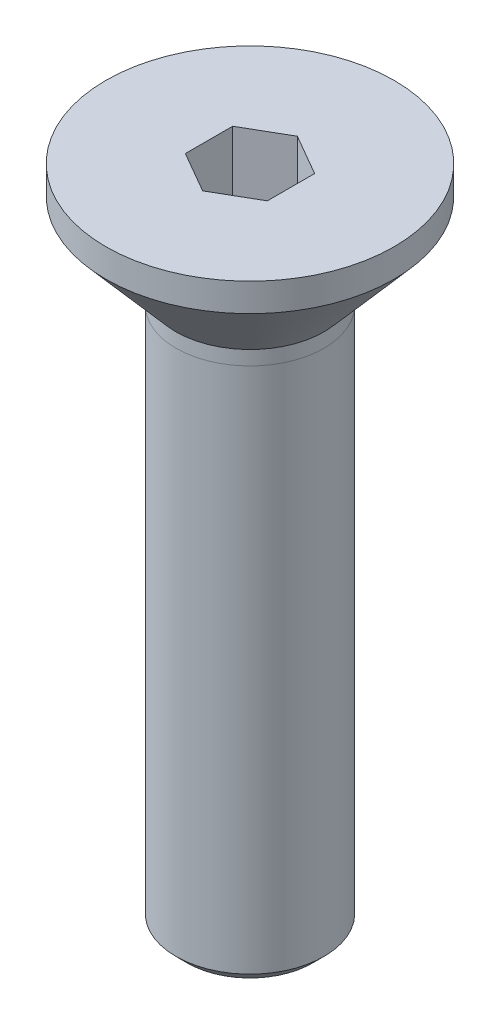
from build123d import *

# Parameters (mm, degrees)
EXTRUDE1_DEPTH = 1.397


with BuildPart() as part:
    # Sketch1 → Revolve1 (revolve)
    with BuildSketch(Plane.XY, mode=Mode.PRIVATE) as revolve1_sk:
        Polygon((0, 0), (0, -12.7), (1.203569231, -12.7), (1.4224, -12.481169231), (1.4224, -2.089184064), (2.7686, -0.540558115), (2.7686, 0), align=None)
    revolve(revolve1_sk.sketch.rotate(Axis((0, 0, 0), (0, -1, 0)), 90), axis=Axis((0, 0, 0), (0, -1, 0)))

    # Sketch2 → Extrude1 (cut)
    with BuildSketch(Plane(origin=(0, 0, 0), x_dir=(1, 0, 0), z_dir=(0, 1, 0))):
        Polygon((0, 0.909211204), (-0.7874, 0.454605602), (-0.7874, -0.454605602), (0, -0.909211204), (0.7874, -0.454605602), (0.7874, 0.454605602), align=None)
    extrude(amount=-EXTRUDE1_DEPTH, mode=Mode.SUBTRACT)


solid = part.part
